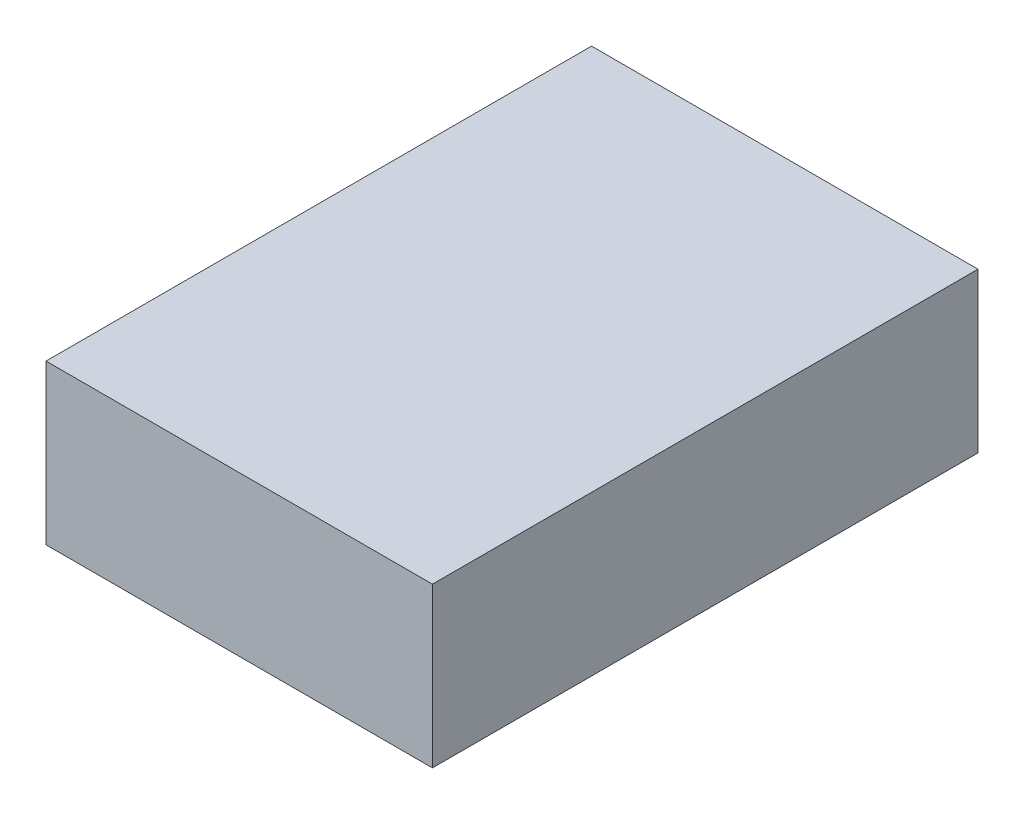
from build123d import *

# Parameters (mm, degrees)
SKETCH1_W           = 34
SKETCH1_H           = 48
BOSS_EXTRUDE1_DEPTH = 14


with BuildPart() as part:
    # Sketch1 → Boss-Extrude1 (new body)
    with BuildSketch(Plane(origin=(0, 0, 0), x_dir=(1, 0, 0), z_dir=(0, 1, 0))):
        Rectangle(SKETCH1_W, SKETCH1_H)
    extrude(amount=BOSS_EXTRUDE1_DEPTH)


solid = part.part
